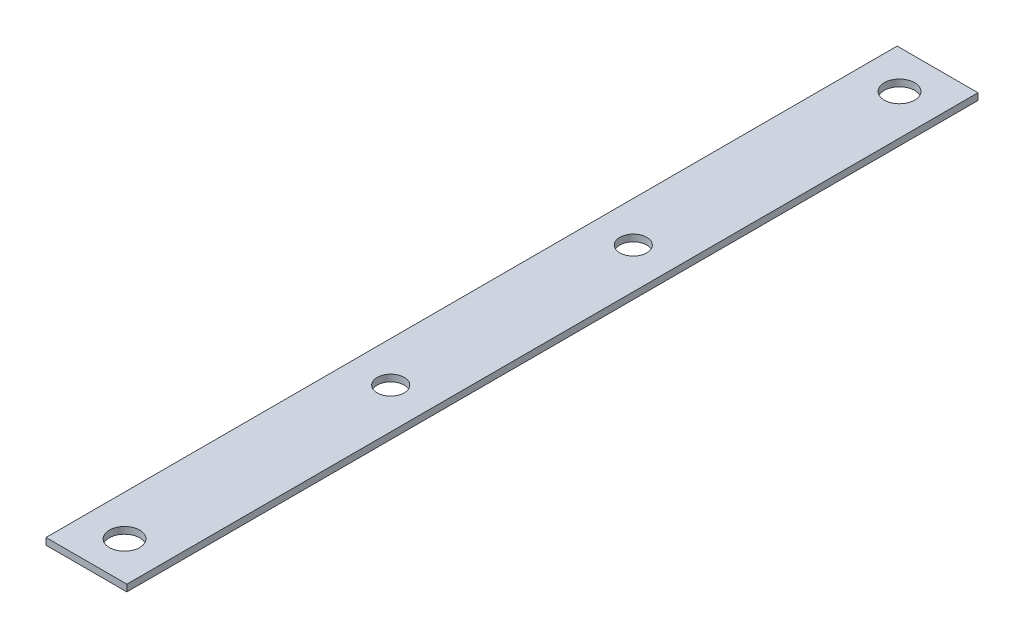
from build123d import *

# Parameters (mm, degrees)
SKETCH1_W           = 38.1
SKETCH1_H           = 3.175
BOSS_EXTRUDE1_DEPTH = 401.0152
SKETCH2_R           = 7.14375
SKETCH2_R_2         = 6.35
CUT_EXTRUDE1_DEPTH  = 403.833565205


with BuildPart() as part:
    # Sketch1 → Boss-Extrude1 (new body)
    with BuildSketch(Plane.XY):
        with Locations((19.05, 1.5875)):
            Rectangle(SKETCH1_W, SKETCH1_H)
    extrude(amount=BOSS_EXTRUDE1_DEPTH)

    # Sketch2 → Cut-Extrude1 (cut, through all)
    with BuildSketch(Plane(origin=(0, 3.175, 0), x_dir=(1, 0, 0), z_dir=(0, 1, 0))):
        with Locations(Location((19.05, -383.0701, 0), (0, 0, 270))):
            Circle(SKETCH2_R)
        with Locations(Location((19.05, -17.9451, 0), (0, 0, 270))):
            Circle(SKETCH2_R)
        with Locations(Location((19.05, -257.6576, 0), (0, 0, 270))):
            Circle(SKETCH2_R_2)
        with Locations(Location((19.05, -143.3576, 0), (0, 0, 270))):
            Circle(SKETCH2_R_2)
    extrude(amount=-CUT_EXTRUDE1_DEPTH, mode=Mode.SUBTRACT)


solid = part.part
